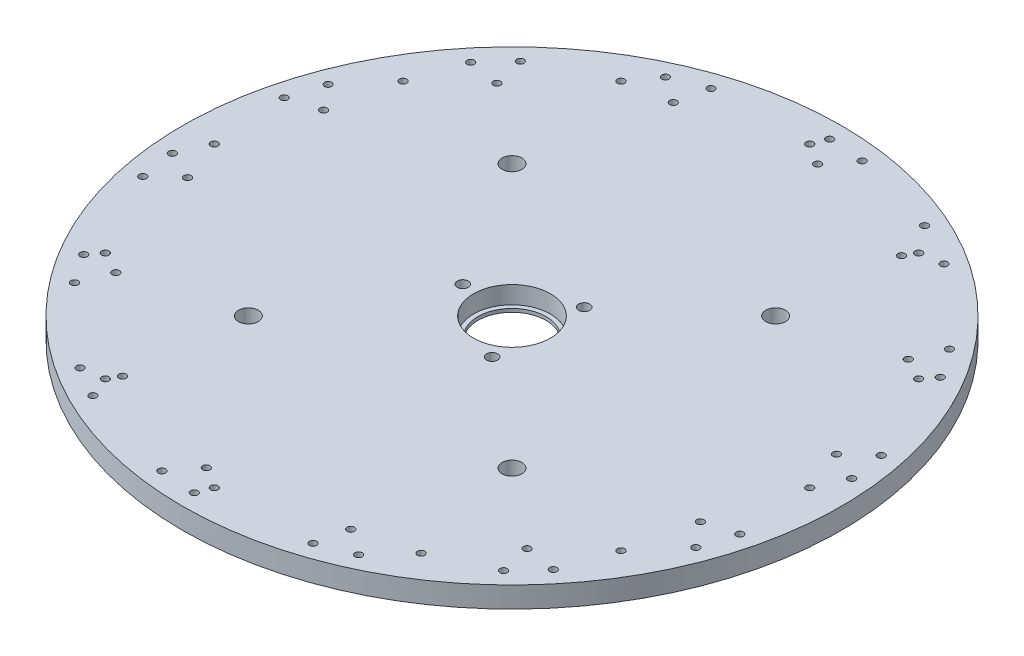
from build123d import *

# Parameters (mm, degrees)
SKETCH1_R           = 150
BOSS_EXTRUDE1_DEPTH = 9.52
SKETCH2_R           = 15.5
CUT_EXTRUDE1_DEPTH  = 213.345544808
SKETCH3_R           = 17.505
CUT_EXTRUDE2_DEPTH  = 8
SKETCH4_R           = 2.5
SKETCH4_R_2         = 1.65
CUT_EXTRUDE3_DEPTH  = 213.345544808
SKETCH6_R           = 1.65
CUT_EXTRUDE5_DEPTH  = 213.345544808
SKETCH7_R           = 4.5
CUT_EXTRUDE6_DEPTH  = 213.345544808


with BuildPart() as part:
    # Sketch1 → Boss-Extrude1 (new body)
    with BuildSketch(Plane(origin=(0, 0, 0), x_dir=(1, 0, 0), z_dir=(0, 1, 0))):
        with Locations(Location((0, 0, 0), (0, 0, 270))):
            Circle(SKETCH1_R)
    extrude(amount=BOSS_EXTRUDE1_DEPTH)

    # Sketch2 → Cut-Extrude1 (cut, through all)
    with BuildSketch(Plane(origin=(0, 9.52, 0), x_dir=(1, 0, 0), z_dir=(0, 1, 0))):
        with Locations(Location((0, 0, 0), (0, 0, 270))):
            Circle(SKETCH2_R)
    extrude(amount=-CUT_EXTRUDE1_DEPTH, mode=Mode.SUBTRACT)

    # Sketch3 → Cut-Extrude2 (cut)
    with BuildSketch(Plane(origin=(0, 9.52, 0), x_dir=(1, 0, 0), z_dir=(0, 1, 0))):
        with Locations(Location((0, 0, 0), (0, 0, 270))):
            Circle(SKETCH3_R)
    extrude(amount=-CUT_EXTRUDE2_DEPTH, mode=Mode.SUBTRACT)

    # Sketch4 → Cut-Extrude3 (cut, through all)
    with BuildSketch(Plane(origin=(0, 9.52, 0), x_dir=(1, 0, 0), z_dir=(0, 1, 0))):
        with Locations(Location((11.649410714, -20.699576959, 0), (0, 0, 270))):
            Circle(SKETCH4_R)
        with Locations(Location((-23.716438501, 1.308358157, 0), (0, 0, 270))):
            Circle(SKETCH4_R)
        with Locations(Location((12.991290652, 19.884859151, 0), (0, 0, 270))):
            Circle(SKETCH4_R)
        with Locations(Location((72.859486405, -114.244235044, 0), (0, 0, 270))):
            Circle(SKETCH4_R_2)
        with Locations(Location((0, -135.5, 0), (0, 0, 270))):
            Circle(SKETCH4_R_2)
        with Locations(Location((-67.75, -117.346442213, 0), (0, 0, 270))):
            Circle(SKETCH4_R_2)
        with Locations(Location((-117.346442213, -67.75, 0), (0, 0, 270))):
            Circle(SKETCH4_R_2)
        with Locations(Location((-135.5, 0, 0), (0, 0, 270))):
            Circle(SKETCH4_R_2)
        with Locations(Location((-117.346442213, 67.75, 0), (0, 0, 270))):
            Circle(SKETCH4_R_2)
        with Locations(Location((-67.75, 117.346442213, 0), (0, 0, 270))):
            Circle(SKETCH4_R_2)
        with Locations(Location((0, 135.5, 0), (0, 0, 270))):
            Circle(SKETCH4_R_2)
        with Locations(Location((67.75, 117.346442213, 0), (0, 0, 270))):
            Circle(SKETCH4_R_2)
        with Locations(Location((117.346442213, 67.75, 0), (0, 0, 270))):
            Circle(SKETCH4_R_2)
        with Locations(Location((135.5, 0, 0), (0, 0, 270))):
            Circle(SKETCH4_R_2)
        with Locations(Location((117.346442213, -67.75, 0), (0, 0, 270))):
            Circle(SKETCH4_R_2)
    extrude(amount=-CUT_EXTRUDE3_DEPTH, mode=Mode.SUBTRACT)

    # Sketch6 → Cut-Extrude5 (cut, through all)
    with BuildSketch(Plane(origin=(0, 0, 0), x_dir=(-1, 0, 0), z_dir=(0, -1, 0))):
        with Locations(Location((-58.31060664, 129.487927243, 0), (0, 0, 90))):
            Circle(SKETCH6_R)
        with Locations(Location((-77.821168587, 118.790217897, 0), (0, 0, 90))):
            Circle(SKETCH6_R)
        with Locations(Location((-64.892965357, 112.397913052, 0), (0, 0, 90))):
            Circle(SKETCH6_R)
        with Locations(Location((-9.698914748, 129.423022928, 0), (0, 0, 90))):
            Circle(SKETCH6_R)
        with Locations(Location((-2.618045494, 141.987309243, 0), (0, 0, 90))):
            Circle(SKETCH6_R)
        with Locations(Location((-18.573306249, 140.791627746, 0), (0, 0, 90))):
            Circle(SKETCH6_R)
        with Locations(Location((59.247207157, 129.062072633, 0), (0, 0, 90))):
            Circle(SKETCH6_R)
        with Locations(Location((44.353227178, 134.907529023, 0), (0, 0, 90))):
            Circle(SKETCH6_R)
        with Locations(Location((47.416124875, 120.814315845, 0), (0, 0, 90))):
            Circle(SKETCH6_R)
        with Locations(Location((109.377823811, 90.574509696, 0), (0, 0, 90))):
            Circle(SKETCH6_R)
        with Locations(Location((98.495060007, 102.303339645, 0), (0, 0, 90))):
            Circle(SKETCH6_R)
        with Locations(Location((95.139819447, 88.276851818, 0), (0, 0, 90))):
            Circle(SKETCH6_R)
        with Locations(Location((133.128738238, 49.436719183, 0), (0, 0, 90))):
            Circle(SKETCH6_R)
        with Locations(Location((124.019905964, 38.255074644, 0), (0, 0, 90))):
            Circle(SKETCH6_R)
        with Locations(Location((137.844821028, 34.14755429, 0), (0, 0, 90))):
            Circle(SKETCH6_R)
        with Locations(Location((141.394637144, -13.221449816, 0), (0, 0, 90))):
            Circle(SKETCH6_R)
        with Locations(Location((128.3363291, -19.343589231, 0), (0, 0, 90))):
            Circle(SKETCH6_R)
        with Locations(Location((139.009960885, -29.042743035, 0), (0, 0, 90))):
            Circle(SKETCH6_R)
        with Locations(Location((121.655594073, -73.260948528, 0), (0, 0, 90))):
            Circle(SKETCH6_R)
        with Locations(Location((112.642473144, -86.480768917, 0), (0, 0, 90))):
            Circle(SKETCH6_R)
        with Locations(Location((107.234168316, -73.111018025, 0), (0, 0, 90))):
            Circle(SKETCH6_R)
        with Locations(Location((64.892965357, -112.397913052, 0), (0, 0, 90))):
            Circle(SKETCH6_R)
        with Locations(Location((63.964762127, -126.790217897, 0), (0, 0, 90))):
            Circle(SKETCH6_R)
        with Locations(Location((77.821168587, -118.790217897, 0), (0, 0, 90))):
            Circle(SKETCH6_R)
        with Locations(Location((9.698914748, -129.423022928, 0), (0, 0, 90))):
            Circle(SKETCH6_R)
        with Locations(Location((2.618045494, -141.987309243, 0), (0, 0, 90))):
            Circle(SKETCH6_R)
        with Locations(Location((18.573306249, -140.791627746, 0), (0, 0, 90))):
            Circle(SKETCH6_R)
        with Locations(Location((-44.353227178, -134.907529023, 0), (0, 0, 90))):
            Circle(SKETCH6_R)
        with Locations(Location((-59.247207157, -129.062072633, 0), (0, 0, 90))):
            Circle(SKETCH6_R)
        with Locations(Location((-47.416124875, -120.814315845, 0), (0, 0, 90))):
            Circle(SKETCH6_R)
        with Locations(Location((-98.495060007, -102.303339645, 0), (0, 0, 90))):
            Circle(SKETCH6_R)
        with Locations(Location((-109.377823811, -90.574509696, 0), (0, 0, 90))):
            Circle(SKETCH6_R)
        with Locations(Location((-95.139819447, -88.276851818, 0), (0, 0, 90))):
            Circle(SKETCH6_R)
        with Locations(Location((-124.019905964, -38.255074644, 0), (0, 0, 90))):
            Circle(SKETCH6_R)
        with Locations(Location((-137.844821028, -34.14755429, 0), (0, 0, 90))):
            Circle(SKETCH6_R)
        with Locations(Location((-133.128738238, -49.436719183, 0), (0, 0, 90))):
            Circle(SKETCH6_R)
        with Locations(Location((-128.3363291, 19.343589231, 0), (0, 0, 90))):
            Circle(SKETCH6_R)
        with Locations(Location((-141.394637144, 13.221449816, 0), (0, 0, 90))):
            Circle(SKETCH6_R)
        with Locations(Location((-139.009960885, 29.042743035, 0), (0, 0, 90))):
            Circle(SKETCH6_R)
        with Locations(Location((-107.234168316, 73.111018025, 0), (0, 0, 90))):
            Circle(SKETCH6_R)
        with Locations(Location((-121.655594073, 73.260948528, 0), (0, 0, 90))):
            Circle(SKETCH6_R)
        with Locations(Location((-112.642473144, 86.480768917, 0), (0, 0, 90))):
            Circle(SKETCH6_R)
    extrude(amount=-CUT_EXTRUDE5_DEPTH, mode=Mode.SUBTRACT)

    # Sketch7 → Cut-Extrude6 (cut, through all)
    with BuildSketch(Plane(origin=(0, 9.52, 0), x_dir=(1, 0, 0), z_dir=(0, 1, 0))):
        with Locations(Location((-60, -60, 0), (0, 0, 270))):
            Circle(SKETCH7_R)
        with Locations(Location((60, -60, 0), (0, 0, 270))):
            Circle(SKETCH7_R)
        with Locations(Location((60, 60, 0), (0, 0, 270))):
            Circle(SKETCH7_R)
        with Locations(Location((-60, 60, 0), (0, 0, 270))):
            Circle(SKETCH7_R)
    extrude(amount=-CUT_EXTRUDE6_DEPTH, mode=Mode.SUBTRACT)


solid = part.part
